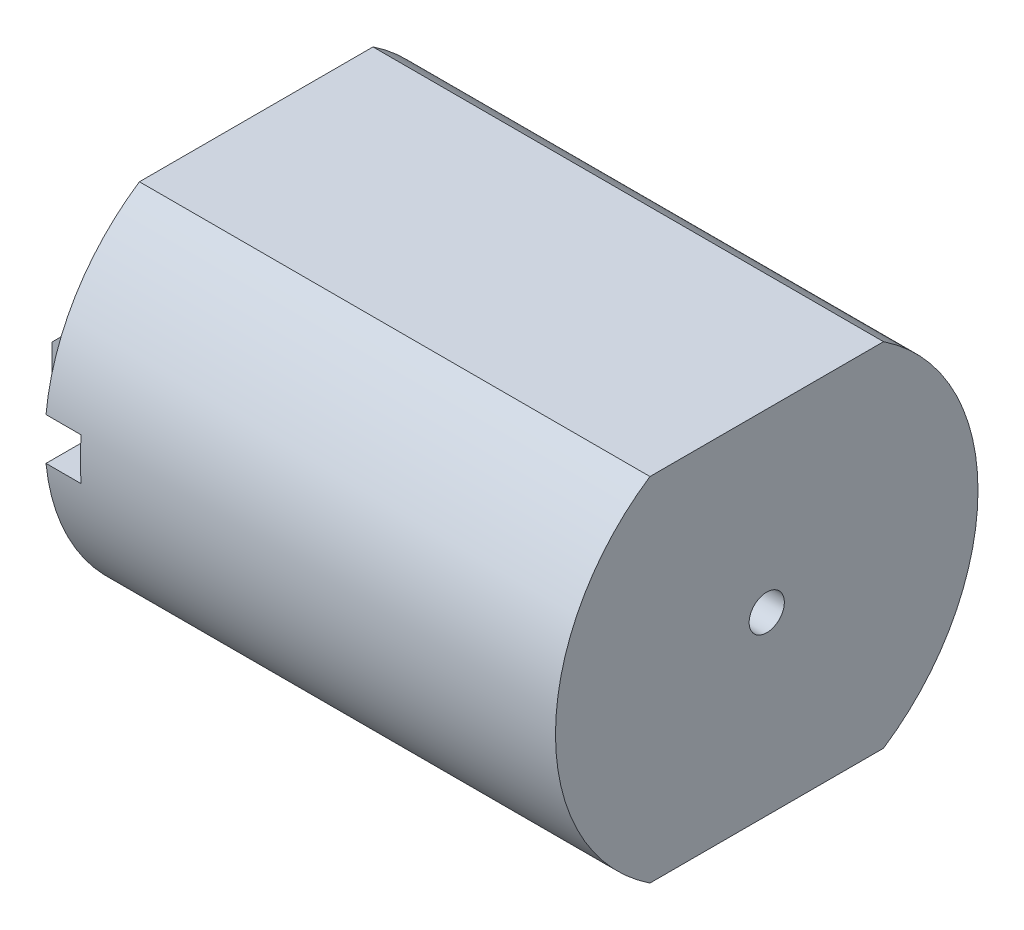
from build123d import *

# Parameters (mm, degrees)
SALIENTE_EXTRUIR1_DEPTH = 13.5
SALIENTE_EXTRUIR2_START = 1
SALIENTE_EXTRUIR2_DEPTH = 1
CROQUIS3_R              = 2.5
CROQUIS3_R_2            = 0.5
SALIENTE_EXTRUIR3_DEPTH = 1
REDONDEO1_R             = 0.25
CORTAR_EXTRUIR1_START   = -14.5
CROQUIS3_2_R            = 0.5
CORTAR_EXTRUIR1_DEPTH   = 14.5
CROQUIS4_R              = 0.5
SALIENTE_EXTRUIR4_DEPTH = 0.25
MATRIZL1_COUNT          = 2
MATRIZL1_PITCH          = 8


with BuildPart() as part:
    # Croquis1 → Saliente-Extruir1 (new body)
    with BuildSketch(Plane(origin=(0, 0, 0), x_dir=(0, 0, -1), z_dir=(1, 0, 0))):
        with BuildLine():
            Line((-3.31662479, 5), (3.31662479, 5))
            ThreePointArc((3.31662479, 5), (6, 0), (3.31662479, -5))
            Line((3.31662479, -5), (-3.31662479, -5))
            ThreePointArc((-3.31662479, -5), (-6, 0), (-3.31662479, 5))
        make_face()
    extrude(amount=SALIENTE_EXTRUIR1_DEPTH)

    # Croquis2 → Saliente-Extruir2 (add)
    with BuildSketch(Plane.ZY.offset(SALIENTE_EXTRUIR2_START)):
        with BuildLine():
            Line((-4.969924623, 0.6), (-4.969924623, -0.6))
            Line((-4.969924623, -0.6), (-5.969924623, -0.6))
            ThreePointArc((-5.969924623, -0.6), (-5.138093031, -3.098386677), (-3.31662479, -5))
            Line((-3.31662479, -5), (3.31662479, -5))
            ThreePointArc((3.31662479, -5), (5.138093031, -3.098386677), (5.969924623, -0.6))
            Line((5.969924623, -0.6), (4.969924623, -0.6))
            Line((4.969924623, -0.6), (4.969924623, 0.6))
            Line((4.969924623, 0.6), (5.969924623, 0.6))
            ThreePointArc((5.969924623, 0.6), (5.138093031, 3.098386677), (3.31662479, 5))
            Line((3.31662479, 5), (-3.31662479, 5))
            ThreePointArc((-3.31662479, 5), (-5.138093031, 3.098386677), (-5.969924623, 0.6))
            Line((-5.969924623, 0.6), (-4.969924623, 0.6))
        make_face()
    extrude(amount=-SALIENTE_EXTRUIR2_DEPTH)

    # Croquis3 → Saliente-Extruir3 (add)
    with BuildSketch(Plane.ZY.offset(1)):
        Circle(CROQUIS3_R)
        Circle(CROQUIS3_R_2, mode=Mode.SUBTRACT)
    extrude(amount=SALIENTE_EXTRUIR3_DEPTH)

    # Redondeo1
    redondeo1_edges = [part.edges().sort_by_distance(p)[0] for p in [
        (-2, 0, -2.5),
    ]]
    fillet(redondeo1_edges, radius=REDONDEO1_R)

    # Croquis3<2> → Cortar-Extruir1 (cut)
    with BuildSketch(Plane.ZY.offset(1).offset(CORTAR_EXTRUIR1_START)):
        with Locations(Location((0, 0, 0), (0, 0, 180))):
            Circle(CROQUIS3_2_R)
    extrude(amount=CORTAR_EXTRUIR1_DEPTH, mode=Mode.SUBTRACT)

    # Croquis4 → Saliente-Extruir4 (add)
    with BuildSketch(Plane.XY.offset(4)):
        Polygon((-2.55, 0.75), (-1, 0.75), (-1, -0.75), (-2.55, -0.75), (-2.8, -0.5), (-2.8, 0.5), align=None)
        with Locations((-2.15, 0)):
            Circle(CROQUIS4_R, mode=Mode.SUBTRACT)
    saliente_extruir4 = extrude(amount=-SALIENTE_EXTRUIR4_DEPTH)

    # MatrizL1: Saliente-Extruir4 ×2
    with Locations(*[(0, 0, -i * MATRIZL1_PITCH) for i in range(1, MATRIZL1_COUNT)]):
        add(saliente_extruir4)


solid = part.part
